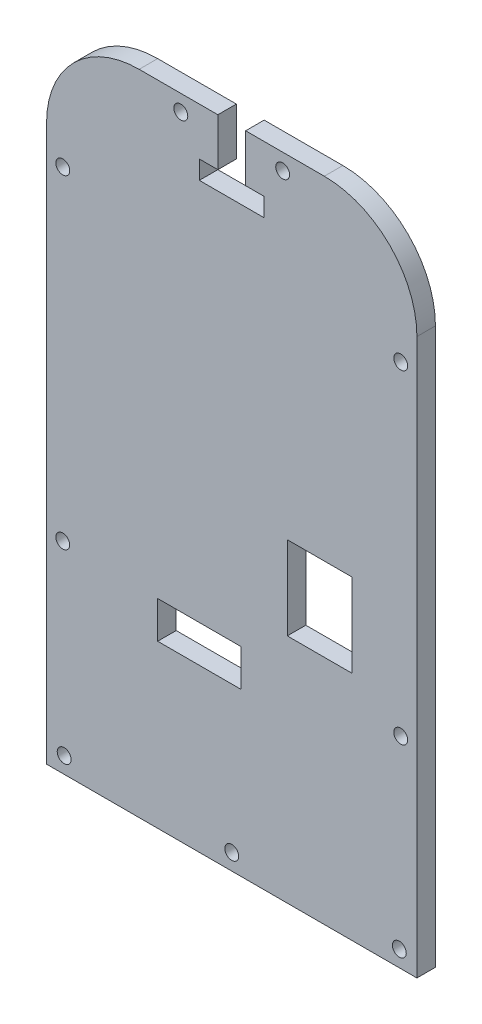
from build123d import *

# Parameters (mm, degrees)
CROQUIS1_W              = 40
CROQUIS1_H              = 70
SALIENTE_EXTRUIR1_DEPTH = 2
REDONDEO1_R             = 10
CORTAR_EXTRUIR1_REACH   = 50.558
CROQUIS2_R              = 0.75
CORTAR_EXTRUIR2_REACH   = 50.558
CROQUIS3_W              = 7
CROQUIS3_H              = 2
CORTAR_EXTRUIR3_REACH   = 50.558
CROQUIS4_W              = 3
CROQUIS4_H              = 5.138146931
CROQUIS4_W_2            = 7
CROQUIS4_H_2            = 9
CROQUIS4_W_3            = 9
CROQUIS4_H_3            = 4


with BuildPart() as part:
    # Croquis1 → Saliente-Extruir1 (new body)
    with BuildSketch(Plane.XY):
        with Locations((0.083817915, -9.164456233)):
            Rectangle(CROQUIS1_W, CROQUIS1_H)
    extrude(amount=SALIENTE_EXTRUIR1_DEPTH)

    # Redondeo1
    redondeo1_edges = [part.edges().sort_by_distance(p)[0] for p in [
        (-19.916182085, 25.835543767, 1),
        (20.083817915, 25.835543767, 1),
    ]]
    fillet(redondeo1_edges, radius=REDONDEO1_R)

    # Croquis2 → Cortar-Extruir1 (cut, up to next)
    with BuildSketch(Plane(origin=(0, 0, 0), x_dir=(-1, 0, 0), z_dir=(0, 0, -1)), mode=Mode.PRIVATE) as cortar_extruir1_sk1:
        with Locations((-5.583817915, 24.085543767)):
            Circle(CROQUIS2_R)
    cortar_extruir1_tool1 = extrude(cortar_extruir1_sk1.sketch, amount=-CORTAR_EXTRUIR1_REACH, mode=Mode.PRIVATE) & part.part
    # Croquis2 → Cortar-Extruir1 (cut, up to next)
    with BuildSketch(Plane(origin=(0, 0, 0), x_dir=(-1, 0, 0), z_dir=(0, 0, -1)), mode=Mode.PRIVATE) as cortar_extruir1_sk2:
        with Locations((5.416182085, 24.085543767)):
            Circle(CROQUIS2_R)
    cortar_extruir1_tool2 = extrude(cortar_extruir1_sk2.sketch, amount=-CORTAR_EXTRUIR1_REACH, mode=Mode.PRIVATE) & part.part
    # Croquis2 → Cortar-Extruir1 (cut, up to next)
    with BuildSketch(Plane(origin=(0, 0, 0), x_dir=(-1, 0, 0), z_dir=(0, 0, -1)), mode=Mode.PRIVATE) as cortar_extruir1_sk3:
        with Locations((-18.183817915, -42.414456233)):
            Circle(CROQUIS2_R)
    cortar_extruir1_tool3 = extrude(cortar_extruir1_sk3.sketch, amount=-CORTAR_EXTRUIR1_REACH, mode=Mode.PRIVATE) & part.part
    # Croquis2 → Cortar-Extruir1 (cut, up to next)
    with BuildSketch(Plane(origin=(0, 0, 0), x_dir=(-1, 0, 0), z_dir=(0, 0, -1)), mode=Mode.PRIVATE) as cortar_extruir1_sk4:
        with Locations((-0.083817915, -42.414456233)):
            Circle(CROQUIS2_R)
    cortar_extruir1_tool4 = extrude(cortar_extruir1_sk4.sketch, amount=-CORTAR_EXTRUIR1_REACH, mode=Mode.PRIVATE) & part.part
    # Croquis2 → Cortar-Extruir1 (cut, up to next)
    with BuildSketch(Plane(origin=(0, 0, 0), x_dir=(-1, 0, 0), z_dir=(0, 0, -1)), mode=Mode.PRIVATE) as cortar_extruir1_sk5:
        with Locations((18.016182085, -42.414456233)):
            Circle(CROQUIS2_R)
    cortar_extruir1_tool5 = extrude(cortar_extruir1_sk5.sketch, amount=-CORTAR_EXTRUIR1_REACH, mode=Mode.PRIVATE) & part.part
    # Croquis2 → Cortar-Extruir1 (cut, up to next)
    with BuildSketch(Plane(origin=(0, 0, 0), x_dir=(-1, 0, 0), z_dir=(0, 0, -1)), mode=Mode.PRIVATE) as cortar_extruir1_sk6:
        with Locations((-18.333817915, 12.585543767)):
            Circle(CROQUIS2_R)
    cortar_extruir1_tool6 = extrude(cortar_extruir1_sk6.sketch, amount=-CORTAR_EXTRUIR1_REACH, mode=Mode.PRIVATE) & part.part
    # Croquis2 → Cortar-Extruir1 (cut, up to next)
    with BuildSketch(Plane(origin=(0, 0, 0), x_dir=(-1, 0, 0), z_dir=(0, 0, -1)), mode=Mode.PRIVATE) as cortar_extruir1_sk7:
        with Locations((-18.333817915, -22.414456233)):
            Circle(CROQUIS2_R)
    cortar_extruir1_tool7 = extrude(cortar_extruir1_sk7.sketch, amount=-CORTAR_EXTRUIR1_REACH, mode=Mode.PRIVATE) & part.part
    # Croquis2 → Cortar-Extruir1 (cut, up to next)
    with BuildSketch(Plane(origin=(0, 0, 0), x_dir=(-1, 0, 0), z_dir=(0, 0, -1)), mode=Mode.PRIVATE) as cortar_extruir1_sk8:
        with Locations((18.166182085, 12.585543767)):
            Circle(CROQUIS2_R)
    cortar_extruir1_tool8 = extrude(cortar_extruir1_sk8.sketch, amount=-CORTAR_EXTRUIR1_REACH, mode=Mode.PRIVATE) & part.part
    # Croquis2 → Cortar-Extruir1 (cut, up to next)
    with BuildSketch(Plane(origin=(0, 0, 0), x_dir=(-1, 0, 0), z_dir=(0, 0, -1)), mode=Mode.PRIVATE) as cortar_extruir1_sk9:
        with Locations((18.166182085, -22.414456233)):
            Circle(CROQUIS2_R)
    cortar_extruir1_tool9 = extrude(cortar_extruir1_sk9.sketch, amount=-CORTAR_EXTRUIR1_REACH, mode=Mode.PRIVATE) & part.part
    add(cortar_extruir1_tool1.solids().sort_by_distance((5.583818, 24.085544, 0))[0], mode=Mode.SUBTRACT)
    add(cortar_extruir1_tool2.solids().sort_by_distance((-5.416182, 24.085544, 0))[0], mode=Mode.SUBTRACT)
    add(cortar_extruir1_tool3.solids().sort_by_distance((18.183818, -42.414456, 0))[0], mode=Mode.SUBTRACT)
    add(cortar_extruir1_tool4.solids().sort_by_distance((0.083818, -42.414456, 0))[0], mode=Mode.SUBTRACT)
    add(cortar_extruir1_tool5.solids().sort_by_distance((-18.016182, -42.414456, 0))[0], mode=Mode.SUBTRACT)
    add(cortar_extruir1_tool6.solids().sort_by_distance((18.333818, 12.585544, 0))[0], mode=Mode.SUBTRACT)
    add(cortar_extruir1_tool7.solids().sort_by_distance((18.333818, -22.414456, 0))[0], mode=Mode.SUBTRACT)
    add(cortar_extruir1_tool8.solids().sort_by_distance((-18.166182, 12.585544, 0))[0], mode=Mode.SUBTRACT)
    add(cortar_extruir1_tool9.solids().sort_by_distance((-18.166182, -22.414456, 0))[0], mode=Mode.SUBTRACT)

    # Croquis3 → Cortar-Extruir2 (cut, up to next)
    with BuildSketch(Plane(origin=(0, 0, 0), x_dir=(-1, 0, 0), z_dir=(0, 0, -1)), mode=Mode.PRIVATE) as cortar_extruir2_sk1:
        with Locations((-0.083817915, 19.697396836)):
            Rectangle(CROQUIS3_W, CROQUIS3_H)
    cortar_extruir2_tool1 = extrude(cortar_extruir2_sk1.sketch, amount=-CORTAR_EXTRUIR2_REACH, mode=Mode.PRIVATE) & part.part
    add(cortar_extruir2_tool1.solids().sort_by_distance((0.083818, 19.697397, 0))[0], mode=Mode.SUBTRACT)

    # Croquis4 → Cortar-Extruir3 (cut, up to next)
    with BuildSketch(Plane(origin=(0, 0, 0), x_dir=(-1, 0, 0), z_dir=(0, 0, -1)), mode=Mode.PRIVATE) as cortar_extruir3_sk1:
        with Locations((-0.083817915, 23.266470302)):
            Rectangle(CROQUIS4_W, CROQUIS4_H)
    cortar_extruir3_tool1 = extrude(cortar_extruir3_sk1.sketch, amount=-CORTAR_EXTRUIR3_REACH, mode=Mode.PRIVATE) & part.part
    # Croquis4 → Cortar-Extruir3 (cut, up to next)
    with BuildSketch(Plane(origin=(0, 0, 0), x_dir=(-1, 0, 0), z_dir=(0, 0, -1)), mode=Mode.PRIVATE) as cortar_extruir3_sk2:
        with Locations((-9.583817915, -14.664456233)):
            Rectangle(CROQUIS4_W_2, CROQUIS4_H_2)
    cortar_extruir3_tool2 = extrude(cortar_extruir3_sk2.sketch, amount=-CORTAR_EXTRUIR3_REACH, mode=Mode.PRIVATE) & part.part
    # Croquis4 → Cortar-Extruir3 (cut, up to next)
    with BuildSketch(Plane(origin=(0, 0, 0), x_dir=(-1, 0, 0), z_dir=(0, 0, -1)), mode=Mode.PRIVATE) as cortar_extruir3_sk3:
        with Locations((3.416182085, -24.664456233)):
            Rectangle(CROQUIS4_W_3, CROQUIS4_H_3)
    cortar_extruir3_tool3 = extrude(cortar_extruir3_sk3.sketch, amount=-CORTAR_EXTRUIR3_REACH, mode=Mode.PRIVATE) & part.part
    add(cortar_extruir3_tool1.solids().sort_by_distance((0.083818, 23.26647, 0))[0], mode=Mode.SUBTRACT)
    add(cortar_extruir3_tool2.solids().sort_by_distance((9.583818, -14.664456, 0))[0], mode=Mode.SUBTRACT)
    add(cortar_extruir3_tool3.solids().sort_by_distance((-3.416182, -24.664456, 0))[0], mode=Mode.SUBTRACT)


solid = part.part
